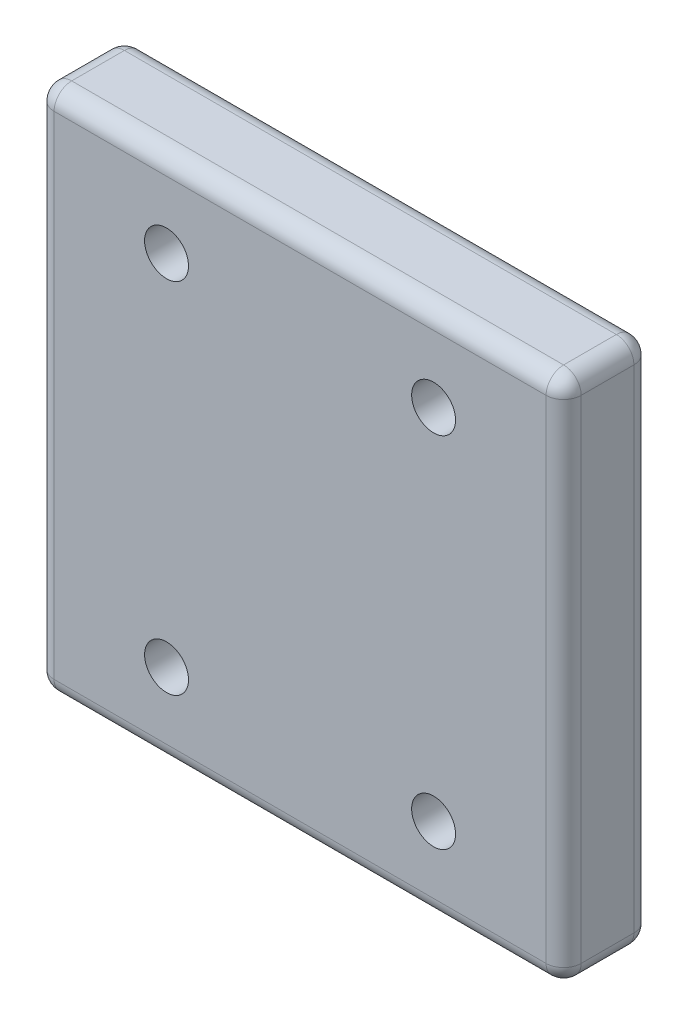
from build123d import *

# Parameters (mm, degrees)
SKETCH1_W           = 19.05
SKETCH1_H           = 19.05
SKETCH1_R           = 0.79375
BOSS_EXTRUDE1_DEPTH = 3.175
FILLET2_R           = 0.635


with BuildPart() as part:
    # Sketch1 → Boss-Extrude1 (new body)
    with BuildSketch(Plane.XY):
        Rectangle(SKETCH1_W, SKETCH1_H)
        with Locations((-4.826, -6.477)):
            Circle(SKETCH1_R, mode=Mode.SUBTRACT)
        with Locations((4.826, -6.477)):
            Circle(SKETCH1_R, mode=Mode.SUBTRACT)
        with Locations(Location((4.826, 6.477, 0), (0, 0, 180))):
            Circle(SKETCH1_R, mode=Mode.SUBTRACT)
        with Locations(Location((-4.826, 6.477, 0), (0, 0, 180))):
            Circle(SKETCH1_R, mode=Mode.SUBTRACT)
    extrude(amount=BOSS_EXTRUDE1_DEPTH)

    # Fillet2
    fillet2_edges = [part.edges().sort_by_distance(p)[0] for p in [
        (0, -9.525, 3.175),
        (9.525, 0, 3.175),
        (0, 9.525, 3.175),
        (9.525, 0, 0),
        (0, -9.525, 0),
        (-9.525, 0, 0),
        (0, 9.525, 0),
        (9.525, 9.525, 1.5875),
        (9.525, -9.525, 1.5875),
        (-9.525, -9.525, 1.5875),
        (-9.525, 9.525, 1.5875),
        (-9.525, 0, 3.175),
    ]]
    fillet(fillet2_edges, radius=FILLET2_R)


solid = part.part
